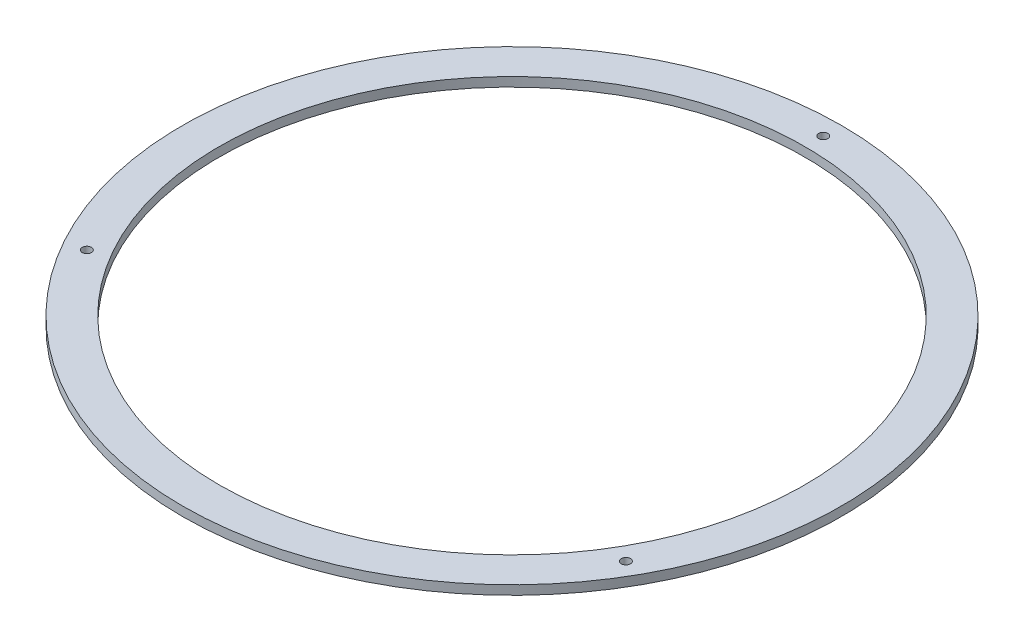
from build123d import *

# Parameters (mm, degrees)
SKETCH1_R               = 228.6
BOSS_EXTRUDE1_DEPTH     = 6.35
CUT_EXTRUDE1_DEPTH      = 324.351577234
CUT_EXTRUDE1_DEPTH_BACK = 324.351577234
SKETCH2_R               = 3.175
CUT_EXTRUDE2_DEPTH      = 324.351577234
CUT_EXTRUDE2_DEPTH_BACK = 324.351577234
SKETCH3_R               = 203.2


with BuildPart() as part:
    # Sketch1 → Boss-Extrude1 (new body)
    with BuildSketch(Plane(origin=(0, 0, 0), x_dir=(1, 0, 0), z_dir=(0, 1, 0))):
        with Locations(Location((0, 0, 0), (0, 0, 270))):
            Circle(SKETCH1_R)
    extrude(amount=BOSS_EXTRUDE1_DEPTH)

    # Sketch2 → Cut-Extrude1 (cut, two sides: drawn at the far end of the back side and taken through both)
    with BuildSketch(Plane(origin=(0, 6.35, 0), x_dir=(1, 0, 0), z_dir=(0, 1, 0)).offset(-CUT_EXTRUDE1_DEPTH_BACK)):
        with Locations(Location((0, 215.9, 0), (0, 0, 270))):
            Circle(SKETCH2_R)
        with Locations(Location((-186.974884677, -107.95, 0), (0, 0, 270))):
            Circle(SKETCH2_R)
        with Locations(Location((186.974884677, -107.95, 0), (0, 0, 270))):
            Circle(SKETCH2_R)
    extrude(amount=CUT_EXTRUDE1_DEPTH + CUT_EXTRUDE1_DEPTH_BACK, mode=Mode.SUBTRACT)

    # Sketch3 → Cut-Extrude2 (cut, two sides: drawn at the far end of the back side and taken through both)
    with BuildSketch(Plane(origin=(0, 6.35, 0), x_dir=(1, 0, 0), z_dir=(0, 1, 0)).offset(-CUT_EXTRUDE2_DEPTH_BACK)):
        with Locations(Location((0, 0, 0), (0, 0, 270))):
            Circle(SKETCH3_R)
    extrude(amount=CUT_EXTRUDE2_DEPTH + CUT_EXTRUDE2_DEPTH_BACK, mode=Mode.SUBTRACT)


solid = part.part
